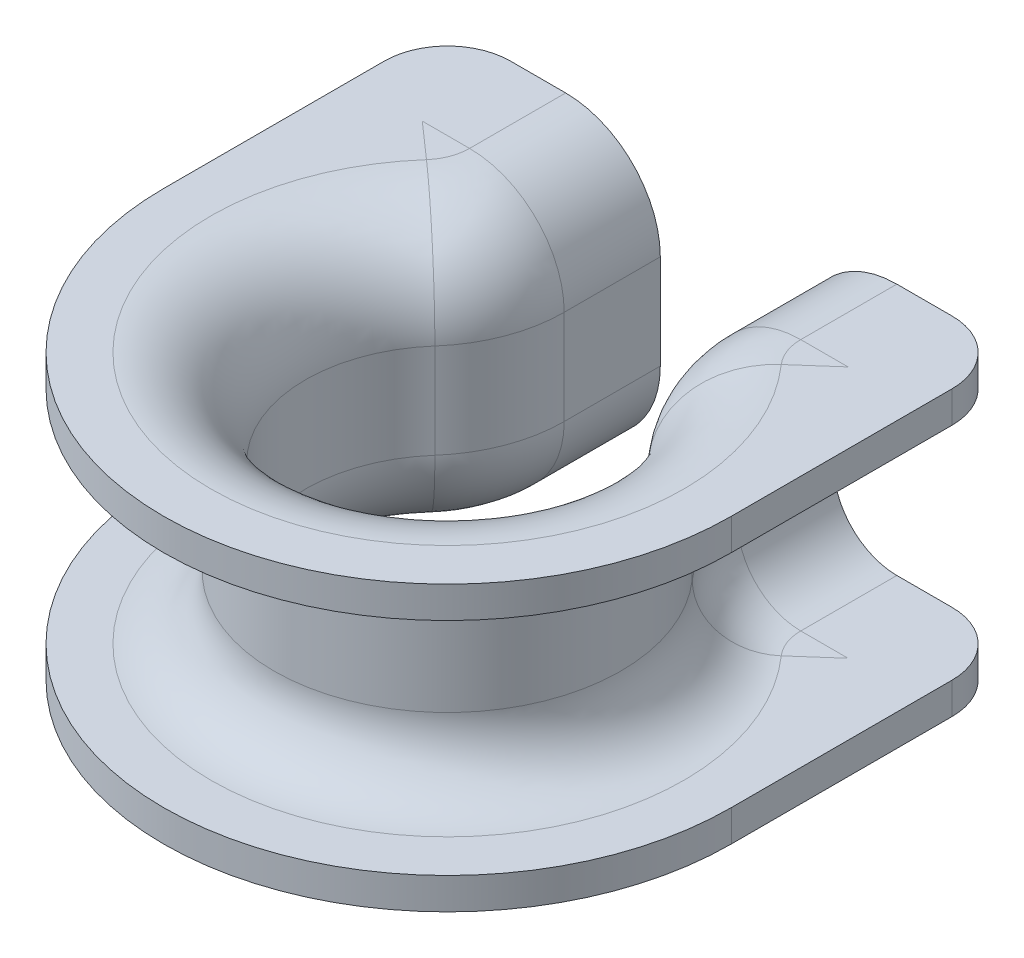
from build123d import *

# Parameters (mm, degrees)
BOSS_EXTRUDE1_START = -9
BOSS_EXTRUDE1_DEPTH = 2
BOSS_EXTRUDE2_START = 7
BOSS_EXTRUDE2_DEPTH = 2


with BuildPart() as part:
    # Sweep1: sweep along a path in Sketch1
    with BuildLine(Plane(origin=(0, 0, 0), x_dir=(1, 0, 0), z_dir=(0, 1, 0))) as sweep1_path:
        Line((-4.5, 18), (-4.5, 11.9058809))
        ThreePointArc((-4.5, 11.9058809), (-5.08127088, 8.723900384), (-6.75, 5.95294045))
        ThreePointArc((-6.75, 5.95294045), (0, -9), (6.75, 5.95294045))
        ThreePointArc((6.75, 5.95294045), (5.08127088, 8.723900384), (4.5, 11.9058809))
        Line((4.5, 11.9058809), (4.5, 18))
    # Sketch2 → Sweep1 (sweep)
    with BuildSketch(Plane(origin=(0, 0, 0), x_dir=(0, 0, -1), z_dir=(1, 0, 0))):
        with BuildLine():
            Line((-9, -3), (-9, 3))
            ThreePointArc((-9, 3), (-10.757359313, 7.242640687), (-15, 9))
            Line((-15, 9), (-18, 9))
            Line((-18, 9), (-18, 7))
            Line((-18, 7), (-15, 7))
            ThreePointArc((-15, 7), (-12.171572875, 5.828427125), (-11, 3))
            Line((-11, 3), (-11, -3))
            ThreePointArc((-11, -3), (-12.171572875, -5.828427125), (-15, -7))
            Line((-15, -7), (-18, -7))
            Line((-18, -7), (-18, -9))
            Line((-18, -9), (-15, -9))
            ThreePointArc((-15, -9), (-10.757359313, -7.242640687), (-9, -3))
        make_face()
    sweep(path=sweep1_path.line)

    # Sketch7 → Boss-Extrude1 (add)
    with BuildSketch(Plane(origin=(0, 0, 0), x_dir=(1, 0, 0), z_dir=(0, 1, 0)).offset(BOSS_EXTRUDE1_START)):
        with BuildLine():
            ThreePointArc((-18, 14), (-16.828427125, 16.828427125), (-14, 18))
            Line((-14, 18), (-13.5, 18))
            Line((-13.5, 18), (-13.5, 11.9058809))
            ThreePointArc((-13.5, 11.9058809), (-16.83745824, 6.363961031), (-18, 0))
            Line((-18, 0), (-18, 14))
        make_face()
        with BuildLine():
            Line((13.5, 11.9058809), (13.5, 18))
            Line((13.5, 18), (14, 18))
            ThreePointArc((14, 18), (16.828427125, 16.828427125), (18, 14))
            Line((18, 14), (18, 0))
            ThreePointArc((18, 0), (16.83745824, 6.363961031), (13.5, 11.9058809))
        make_face()
    extrude(amount=BOSS_EXTRUDE1_DEPTH)

    # Sketch7<4> → Boss-Extrude2 (add)
    with BuildSketch(Plane(origin=(0, 0, 0), x_dir=(1, 0, 0), z_dir=(0, 1, 0)).offset(BOSS_EXTRUDE2_START)):
        with BuildLine():
            ThreePointArc((-18, 14), (-16.828427125, 16.828427125), (-14, 18))
            Line((-14, 18), (-13.5, 18))
            Line((-13.5, 18), (-13.5, 11.9058809))
            ThreePointArc((-13.5, 11.9058809), (-16.83745824, 6.363961031), (-18, 0))
            Line((-18, 0), (-18, 14))
        make_face()
        with BuildLine():
            Line((13.5, 11.9058809), (13.5, 18))
            Line((13.5, 18), (14, 18))
            ThreePointArc((14, 18), (16.828427125, 16.828427125), (18, 14))
            Line((18, 14), (18, 0))
            ThreePointArc((18, 0), (16.83745824, 6.363961031), (13.5, 11.9058809))
        make_face()
    extrude(amount=BOSS_EXTRUDE2_DEPTH)


solid = part.part
